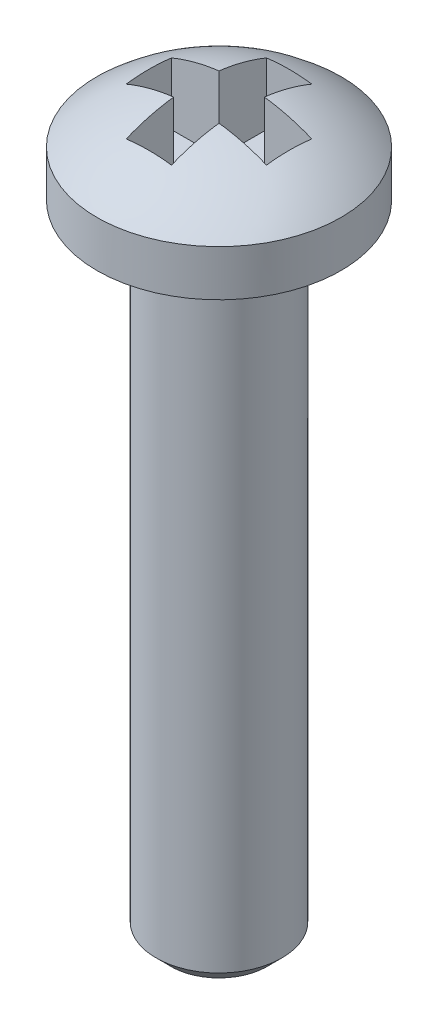
from build123d import *

# Parameters (mm, degrees)
CUT_EXTRUDE1_DEPTH = 1.3462


with BuildPart() as part:
    # Sketch1 → Revolve1 (revolve)
    with BuildSketch(Plane.XY, mode=Mode.PRIVATE) as revolve1_sk:
        with BuildLine():
            Line((0, 12.7127), (0, 0))
            Line((0, 0), (0.8382, 0))
            Line((0.8382, 0), (1.0922, 0.254))
            Line((1.0922, 0.254), (1.0922, 11.1125))
            Line((1.0922, 11.1125), (2.1209, 11.1125))
            Line((2.1209, 11.1125), (2.1209, 11.9126))
            ThreePointArc((2.1209, 11.9126), (1.133399402, 12.506023812), (0, 12.7127))
        make_face()
    revolve(revolve1_sk.sketch.rotate(Axis((0, 0, 0), (0, 1, 0)), 90), axis=Axis((0, 0, 0), (0, 1, 0)))

    # Sketch2 → Cut-Extrude1 (cut)
    with BuildSketch(Plane(origin=(0, 12.7127, 0), x_dir=(1, 0, 0), z_dir=(0, 1, 0))):
        Polygon((-0.3937, 0.3937), (-0.3937, 1.2192), (0.3937, 1.2192), (0.3937, 0.3937), (1.2192, 0.3937), (1.2192, -0.3937), (0.3937, -0.3937), (0.3937, -1.2192), (-0.3937, -1.2192), (-0.3937, -0.3937), (-1.2192, -0.3937), (-1.2192, 0.3937), align=None)
    extrude(amount=-CUT_EXTRUDE1_DEPTH, mode=Mode.SUBTRACT)


solid = part.part
